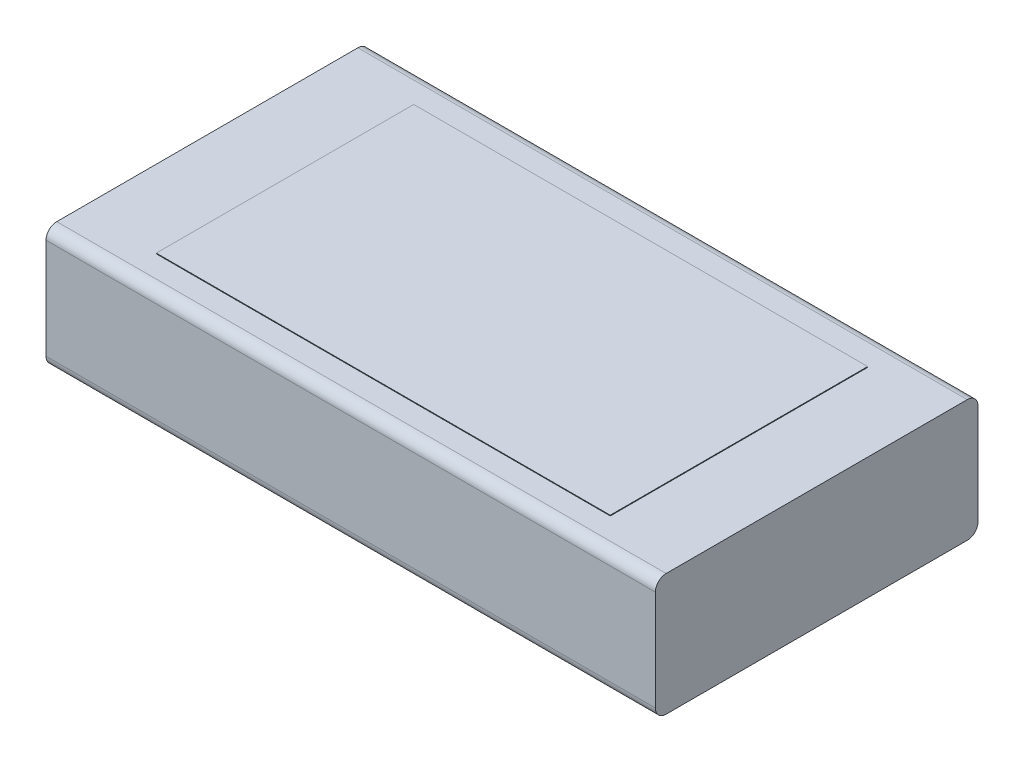
from build123d import *

# Parameters (mm, degrees)
ESBO_O1_W                = 85
ESBO_O1_H                = 45
RESSALTO_EXTRUS_O1_DEPTH = 17
FILETE1_R                = 1.5
ESBO_O2_W                = 63.315602634
ESBO_O2_H                = 35.904579542
RESSALTO_EXTRUS_O2_DEPTH = 0.1


with BuildPart() as part:
    # Esboço1 → Ressalto-extrusão1 (new body)
    with BuildSketch(Plane(origin=(0, 0, 0), x_dir=(1, 0, 0), z_dir=(0, 1, 0))):
        Rectangle(ESBO_O1_W, ESBO_O1_H)
    extrude(amount=RESSALTO_EXTRUS_O1_DEPTH)

    # Filete1
    filete1_edges = [part.edges().sort_by_distance(p)[0] for p in [
        (0, 17, 22.5),
        (0, 0, 22.5),
        (0, 0, -22.5),
        (0, 17, -22.5),
    ]]
    fillet(filete1_edges, radius=FILETE1_R)

    # Esboço2 → Ressalto-extrusão2 (add)
    with BuildSketch(Plane(origin=(0, 17, 0), x_dir=(1, 0, 0), z_dir=(0, 1, 0))):
        Rectangle(ESBO_O2_W, ESBO_O2_H)
    extrude(amount=RESSALTO_EXTRUS_O2_DEPTH)


solid = part.part
